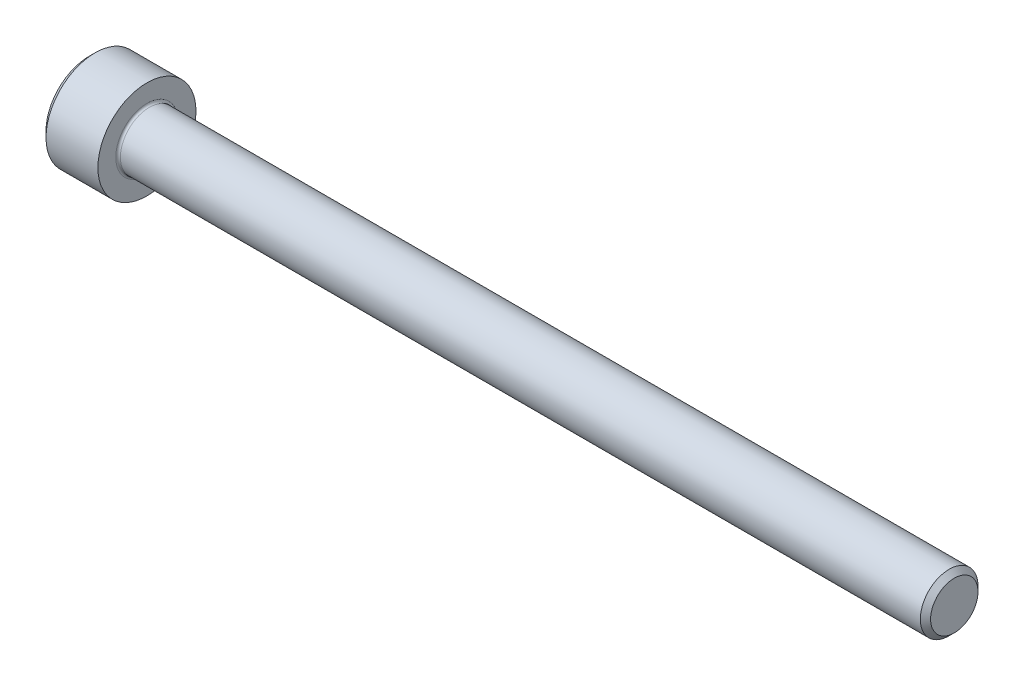
from build123d import *

# Parameters (mm, degrees)
FILLET1_R   = 0.2
HEX_2_DEPTH = 2.5


with BuildPart() as part:
    # BodySke → Base-Revolve (revolve)
    with BuildSketch(Plane.XY, mode=Mode.PRIVATE) as base_revolve_sk:
        Polygon((0, 0), (0, 3.75), (0.5, 4.25), (5, 4.25), (5, 2.5), (74.555, 2.5), (75, 2.055), (75, 0), align=None)
    revolve(base_revolve_sk.sketch.rotate(Axis((-31.75, 0, 0), (1, 0, 0)), 90), axis=Axis((-31.75, 0, 0), (1, 0, 0)))

    # Fillet1
    fillet1_edges = [part.edges().sort_by_distance(p)[0] for p in [
        (5, 0, -2.5),
    ]]
    fillet(fillet1_edges, radius=FILLET1_R)

    # Sketch2 → Hex-PreBroach (revolve, cut)
    with BuildSketch(Plane.XY, mode=Mode.PRIVATE) as hex_prebroach_sk:
        Polygon((0, 2.042), (2.5, 2.042), (3.67894925, 0), (0, 0), align=None)
    revolve(hex_prebroach_sk.sketch.rotate(Axis((0, 0, 0), (1, 0, 0)), 90), axis=Axis((0, 0, 0), (1, 0, 0)), mode=Mode.SUBTRACT)

    # Sketch3 → Hex 2 (cut)
    with BuildSketch(Plane(origin=(0, 0, 0), x_dir=(0, 0.500000000000001, 0.866025403784438), z_dir=(-1, 0, 0))):
        Polygon((1.17894925, 2.042), (-1.17894925, 2.042), (-2.357898499, 0), (-1.17894925, -2.042), (1.17894925, -2.042), (2.357898499, 0), align=None)
    extrude(amount=-HEX_2_DEPTH, mode=Mode.SUBTRACT)


solid = part.part
